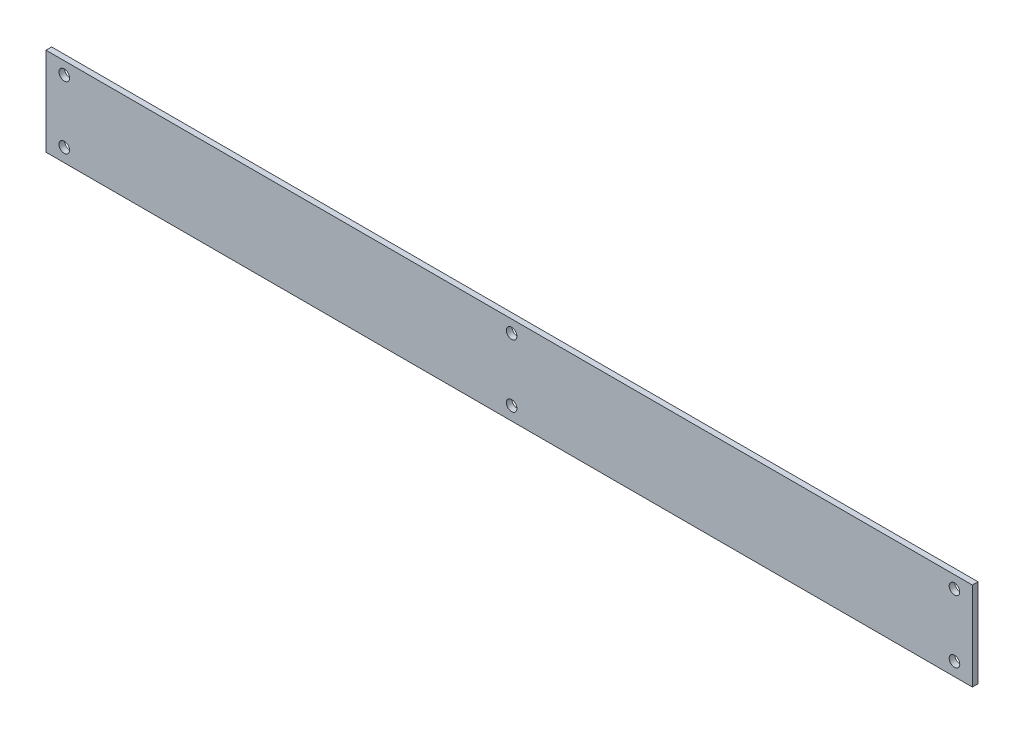
from build123d import *

# Parameters (mm, degrees)
ESQUISSE1_W        = 263
ESQUISSE1_H        = 25.1
BOSS_EXTRU_1_DEPTH = 1.6
SKETCH1_R          = 1.5
CUT_EXTRUDE1_DEPTH = 133.107200788


with BuildPart() as part:
    # Esquisse1 → Boss.-Extru.1 (new body)
    with BuildSketch(Plane.XY):
        Rectangle(ESQUISSE1_W, ESQUISSE1_H)
    extrude(amount=BOSS_EXTRU_1_DEPTH)

    # Sketch1 → Cut-Extrude1 (cut, through all)
    with BuildSketch(Plane.XY.offset(1.6)):
        with Locations((126.42, -8.74)):
            Circle(SKETCH1_R)
        with Locations((126.42, 9.04)):
            Circle(SKETCH1_R)
        with Locations((0.69, -8.74)):
            Circle(SKETCH1_R)
        with Locations((-126.31, -8.74)):
            Circle(SKETCH1_R)
        with Locations((0.69, 9.04)):
            Circle(SKETCH1_R)
        with Locations((-126.31, 9.04)):
            Circle(SKETCH1_R)
    extrude(amount=-CUT_EXTRUDE1_DEPTH, mode=Mode.SUBTRACT)


solid = part.part
